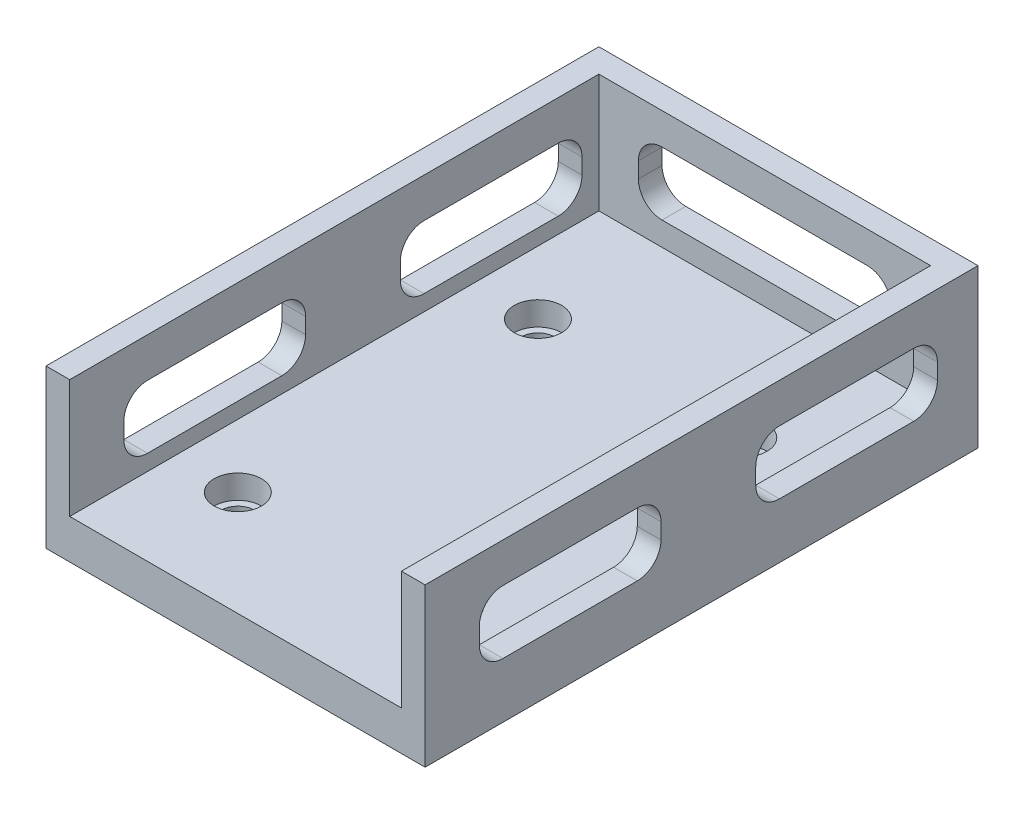
from build123d import *

# Parameters (mm, degrees)
EXTRUDE_1_DEPTH     = 70
SKETCH_2_W          = 3
SKETCH_2_H          = 15
EXTRUDE_2_DEPTH     = 70
EXTRUDE_3_REACH     = 86.588
SKETCH_3_W          = 3
SKETCH_3_H          = 15
CUT_EXTRUDE_1_DEPTH = 87.22126548
CUT_EXTRUDE_2_DEPTH = 73.767483267
SKETCH_6_R          = 3
CUT_EXTRUDE_3_DEPTH = 3
SKETCH_7_R          = 2.1
CUT_EXTRUDE_4_DEPTH = 77.157731059


with BuildPart() as part:
    # 草图1 → 凸台-拉伸1 (new body)
    with BuildSketch(Plane.XY):
        Polygon((0, -15.16926567), (-24, -15.16926567), (-24, -10.16926567), (0, -10.16926567), (24, -10.16926567), (24, -15.16926567), align=None)
    extrude(amount=EXTRUDE_1_DEPTH)

    # 草图2 → 凸台-拉伸2 (add)
    with BuildSketch(Plane(origin=(0, 0, 0), x_dir=(-1, 0, 0), z_dir=(0, 0, -1))):
        with Locations((-22.5, -2.66926567)):
            Rectangle(SKETCH_2_W, SKETCH_2_H)
        with Locations((22.5, -2.66926567)):
            Rectangle(SKETCH_2_W, SKETCH_2_H)
    extrude(amount=-EXTRUDE_2_DEPTH)

    # 草图3 → 凸台-拉伸3 (add, up to next)
    with BuildSketch(Plane.ZY.offset(-21), mode=Mode.PRIVATE) as extrude_3_sk1:
        with Locations((1.5, -2.66926567)):
            Rectangle(SKETCH_3_W, SKETCH_3_H)
    extrude_3_tool1 = extrude(extrude_3_sk1.sketch, amount=EXTRUDE_3_REACH, mode=Mode.PRIVATE) - part.part
    add(extrude_3_tool1.solids().sort_by_distance((21, -2.669266, 1.5))[0])

    # 草图4 → 切除-拉伸1 (cut, through all)
    with BuildSketch(Plane.ZY.offset(24)):
        with BuildLine():
            Line((5.140274164, -3.16926567), (5.140274164, -5.16926567))
            ThreePointArc((5.140274164, -5.16926567), (6.018953821, -7.290586014), (8.140274164, -8.16926567))
            Line((8.140274164, -8.16926567), (25.140274164, -8.16926567))
            ThreePointArc((25.140274164, -8.16926567), (27.261594508, -7.290586014), (28.140274164, -5.16926567))
            Line((28.140274164, -5.16926567), (28.140274164, -3.16926567))
            ThreePointArc((28.140274164, -3.16926567), (27.261594508, -1.047945327), (25.140274164, -0.16926567))
            Line((25.140274164, -0.16926567), (8.140274164, -0.16926567))
            ThreePointArc((8.140274164, -0.16926567), (6.018953821, -1.047945327), (5.140274164, -3.16926567))
        make_face()
        with BuildLine():
            Line((40.140274164, -3.16926567), (40.140274164, -5.16926567))
            ThreePointArc((40.140274164, -5.16926567), (41.018953821, -7.290586014), (43.140274164, -8.16926567))
            Line((43.140274164, -8.16926567), (60.140274164, -8.16926567))
            ThreePointArc((60.140274164, -8.16926567), (62.261594508, -7.290586014), (63.140274164, -5.16926567))
            Line((63.140274164, -5.16926567), (63.140274164, -3.16926567))
            ThreePointArc((63.140274164, -3.16926567), (62.261594508, -1.047945327), (60.140274164, -0.16926567))
            Line((60.140274164, -0.16926567), (43.140274164, -0.16926567))
            ThreePointArc((43.140274164, -0.16926567), (41.018953821, -1.047945327), (40.140274164, -3.16926567))
        make_face()
    extrude(amount=-CUT_EXTRUDE_1_DEPTH, mode=Mode.SUBTRACT)

    # 草图5 → 切除-拉伸2 (cut, through all)
    with BuildSketch(Plane.XY.offset(3)):
        with BuildLine():
            Line((-13, 0.83073433), (13, 0.83073433))
            ThreePointArc((13, 0.83073433), (15.121320344, -0.047945327), (16, -2.16926567))
            Line((16, -2.16926567), (16, -4.16926567))
            ThreePointArc((16, -4.16926567), (15.121320344, -6.290586014), (13, -7.16926567))
            Line((13, -7.16926567), (-13, -7.16926567))
            ThreePointArc((-13, -7.16926567), (-15.121320344, -6.290586014), (-16, -4.16926567))
            Line((-16, -4.16926567), (-16, -2.16926567))
            ThreePointArc((-16, -2.16926567), (-15.121320344, -0.047945327), (-13, 0.83073433))
        make_face()
    extrude(amount=-CUT_EXTRUDE_2_DEPTH, mode=Mode.SUBTRACT)

    # 草图6 → 切除-拉伸3 (cut)
    with BuildSketch(Plane(origin=(0, -10.16926567, 0), x_dir=(1, 0, 0), z_dir=(0, 1, 0))):
        with Locations(Location((-13, -18.714712401, 0), (0, 0, 180))):
            Circle(SKETCH_6_R)
        with Locations(Location((13, -18.714712401, 0), (0, 0, 180))):
            Circle(SKETCH_6_R)
        with Locations(Location((-13, -56.714712401, 0), (0, 0, 180))):
            Circle(SKETCH_6_R)
        with Locations(Location((13, -55.851588753, 0), (0, 0, 180))):
            Circle(SKETCH_6_R)
    extrude(amount=-CUT_EXTRUDE_3_DEPTH, mode=Mode.SUBTRACT)

    # 草图7 → 切除-拉伸4 (cut, through all)
    with BuildSketch(Plane(origin=(0, -13.16926567, 0), x_dir=(1, 0, 0), z_dir=(0, 1, 0))):
        with Locations(Location((-13, -18.714712401, 0), (0, 0, 180))):
            Circle(SKETCH_7_R)
        with Locations(Location((13, -18.714712401, 0), (0, 0, 180))):
            Circle(SKETCH_7_R)
        with Locations(Location((13, -55.851588753, 0), (0, 0, 180))):
            Circle(SKETCH_7_R)
        with Locations(Location((-13, -56.714712401, 0), (0, 0, 180))):
            Circle(SKETCH_7_R)
    extrude(amount=-CUT_EXTRUDE_4_DEPTH, mode=Mode.SUBTRACT)


solid = part.part
